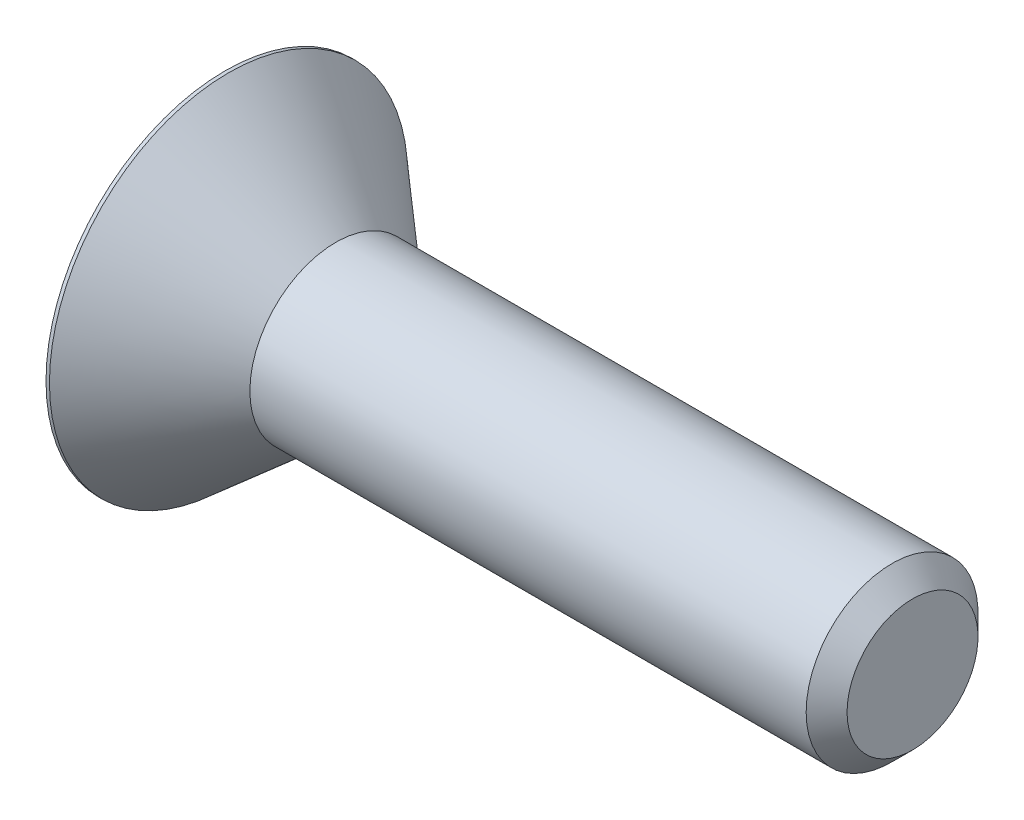
from build123d import *


with BuildPart() as part:
    # BodySke → BaseBody (revolve)
    with BuildSketch(Plane.XY, mode=Mode.PRIVATE) as basebody_sk:
        Polygon((0, 0), (0, 6.61924), (0.127, 6.61924), (4.089144883, 3.175), (24.64435, 3.175), (25.4, 2.41935), (25.4, 0), align=None)
    revolve(basebody_sk.sketch.rotate(Axis((0, 0, 0), (1, 0, 0)), 90), axis=Axis((0, 0, 0), (1, 0, 0)))


solid = part.part
